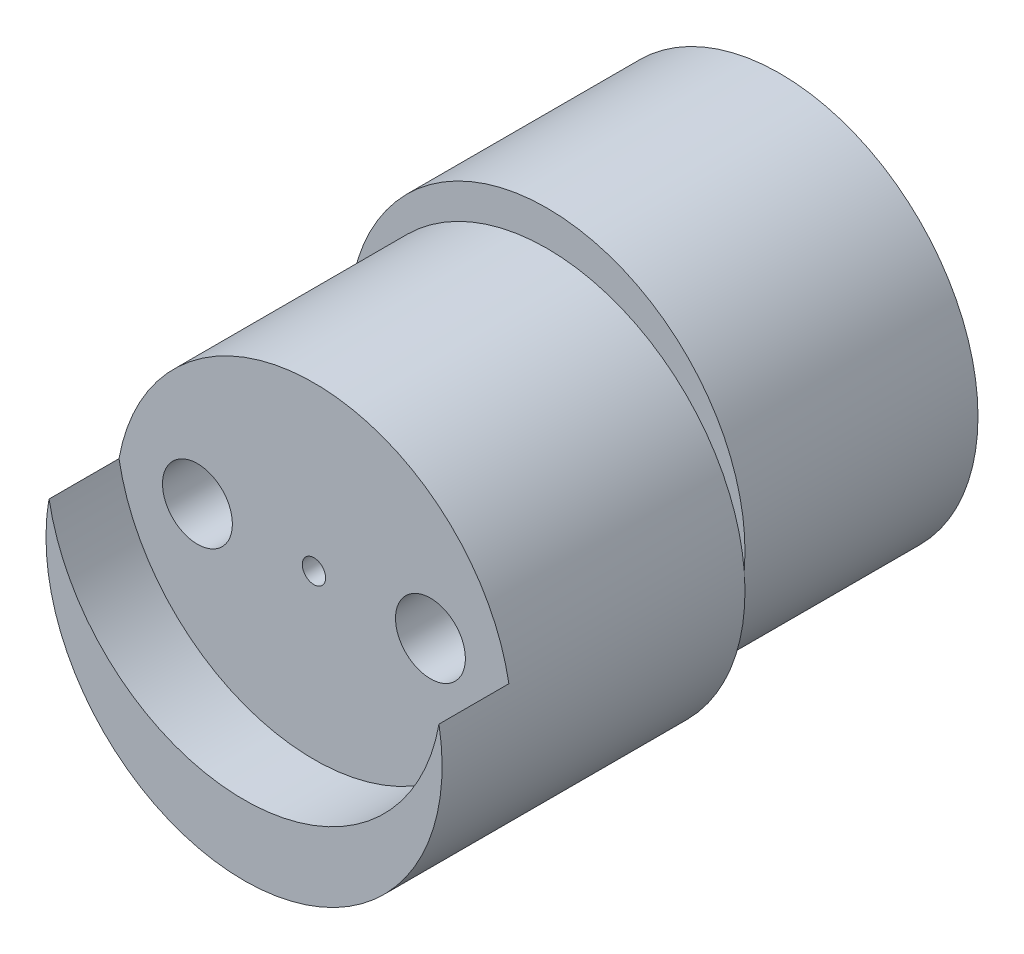
from build123d import *
from build123d.topology import SkipClean

# Parameters (mm, degrees)
SKETCH1_R           = 8.5
BOSS_EXTRUDE1_DEPTH = 10
SKETCH2_R           = 8.5
BOSS_EXTRUDE2_DEPTH = 10
SKETCH4_R           = 0.5
SKETCH4_R_2         = 1.5
CUT_EXTRUDE1_DEPTH  = 20
BOSS_EXTRUDE3_DEPTH = 3


with BuildPart() as part:
    # Sketch1 → Boss-Extrude1 (new body)
    with BuildSketch(Plane.XY):
        Circle(SKETCH1_R)
    extrude(amount=BOSS_EXTRUDE1_DEPTH)

    # Sketch2 → Boss-Extrude2 (add)
    with BuildSketch(Plane.XY.offset(10)):
        with Locations(Location((0, -1.5, 0), (0, 0, 174.937907036))):
            Circle(SKETCH2_R)
    extrude(amount=BOSS_EXTRUDE2_DEPTH)

    # Sketch4 → Cut-Extrude1 (cut)
    with BuildSketch(Plane.XY.offset(20)):
        Circle(SKETCH4_R)
        with Locations((-5, 0)):
            Circle(SKETCH4_R_2)
        with Locations((5, 0)):
            Circle(SKETCH4_R_2)
    extrude(amount=-CUT_EXTRUDE1_DEPTH, mode=Mode.SUBTRACT)

    # Sketch5 → Boss-Extrude3 (add)
    with SkipClean():  # the faces are left unmerged after this step: merging them gives an invalid solid
        with BuildSketch(Plane.XY.offset(20)):
            with BuildLine():
                ThreePointArc((-8.366600265, 0), (0, -7), (8.366600265, 0))
                ThreePointArc((8.366600265, 0), (0, -10), (-8.366600265, 0))
            make_face()
        extrude(amount=BOSS_EXTRUDE3_DEPTH)


solid = part.part
